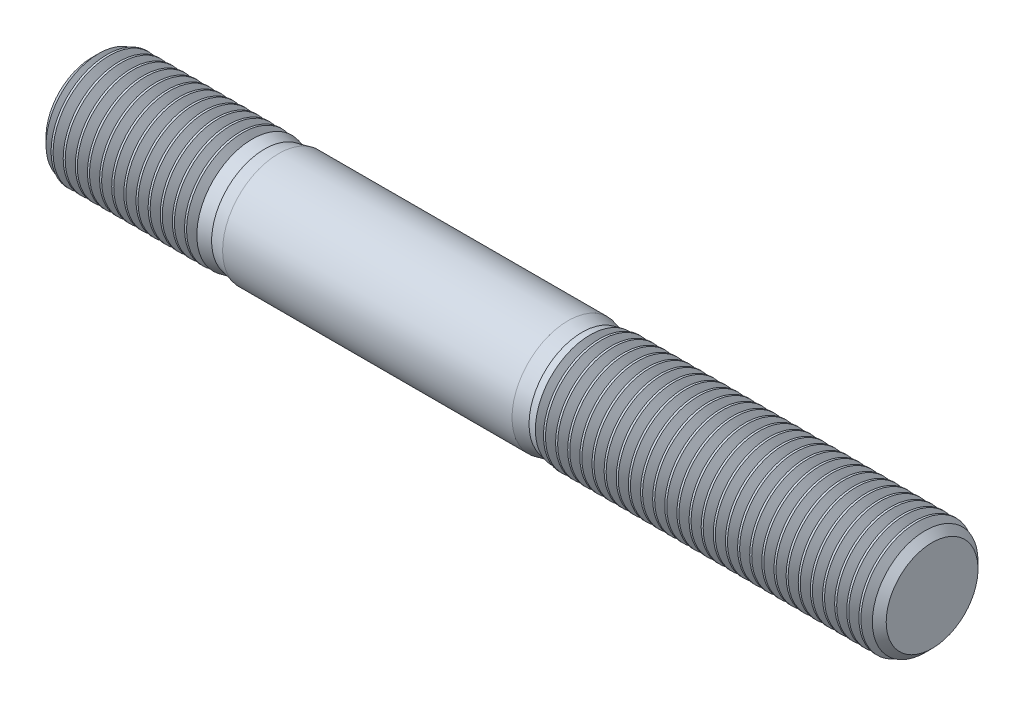
from build123d import *

# Parameters (mm, degrees)
HEADCHAMFER_SIZE = 0.5415
LPATTERN10_COUNT = 28
LPATTERN10_PITCH = 0.6498
LPATTERN11_COUNT = 13
LPATTERN11_PITCH = 0.6498


with BuildPart() as part:
    # Sketch1 → BaseHead (revolve)
    with BuildSketch(Plane.XY, mode=Mode.PRIVATE) as basehead_sk:
        Polygon((0, 0), (0, 3), (8.5, 3), (10, 2.675), (25.5, 2.675), (27, 3), (45, 3), (45, 0), align=None)
    revolve(basehead_sk.sketch.rotate(Axis((-1.310841664, 0, 0), (1, 0, 0)), 90), axis=Axis((-1.310841664, 0, 0), (1, 0, 0)))

    # HeadChamfer
    headchamfer_edges = [part.edges().sort_by_distance(p)[0] for p in [
        (45, 0, -3),
        (0, 0, -3),
    ]]
    chamfer(headchamfer_edges, length=HEADCHAMFER_SIZE)

    # Sketch2 → BaseBody (revolve)
    with BuildSketch(Plane.XY, mode=Mode.PRIVATE) as basebody_sk:
        Polygon((8.5, 2.675), (10, 3), (25.5, 3), (27, 2.675), align=None)
    revolve(basebody_sk.sketch.rotate(Axis((-1.310841664, 0, 0), (1, 0, 0)), 90), axis=Axis((-1.310841664, 0, 0), (1, 0, 0)))

    # Sketch3 → Cut-Revolve10 (revolve, cut)
    with BuildSketch(Plane.XY, mode=Mode.PRIVATE) as cut_revolve10_sk:
        Polygon((44.4585, 2.531047244), (44.72925, 3), (44.72925, 3.5), (44.18775, 3.5), (44.18775, 3), align=None)
    cut_revolve10 = revolve(cut_revolve10_sk.sketch.rotate(Axis((0, 0, 0), (1, 0, 0)), 90), axis=Axis((0, 0, 0), (1, 0, 0)), mode=Mode.SUBTRACT)

    # LPattern10: Cut-Revolve10 ×28
    with Locations(*[(-i * LPATTERN10_PITCH, 0, 0) for i in range(1, LPATTERN10_COUNT)]):
        add(cut_revolve10, mode=Mode.SUBTRACT)

    # Sketch4 → Cut-Revolve11 (revolve, cut)
    with BuildSketch(Plane.XY, mode=Mode.PRIVATE) as cut_revolve11_sk:
        Polygon((0.5415, 2.531047244), (0.81225, 3), (0.81225, 3.5), (0.27075, 3.5), (0.27075, 3), align=None)
    cut_revolve11 = revolve(cut_revolve11_sk.sketch.rotate(Axis((0, 0, 0), (1, 0, 0)), 90), axis=Axis((0, 0, 0), (1, 0, 0)), mode=Mode.SUBTRACT)

    # LPattern11: Cut-Revolve11 ×13
    with Locations(*[(i * LPATTERN11_PITCH, 0, 0) for i in range(1, LPATTERN11_COUNT)]):
        add(cut_revolve11, mode=Mode.SUBTRACT)


solid = part.part
